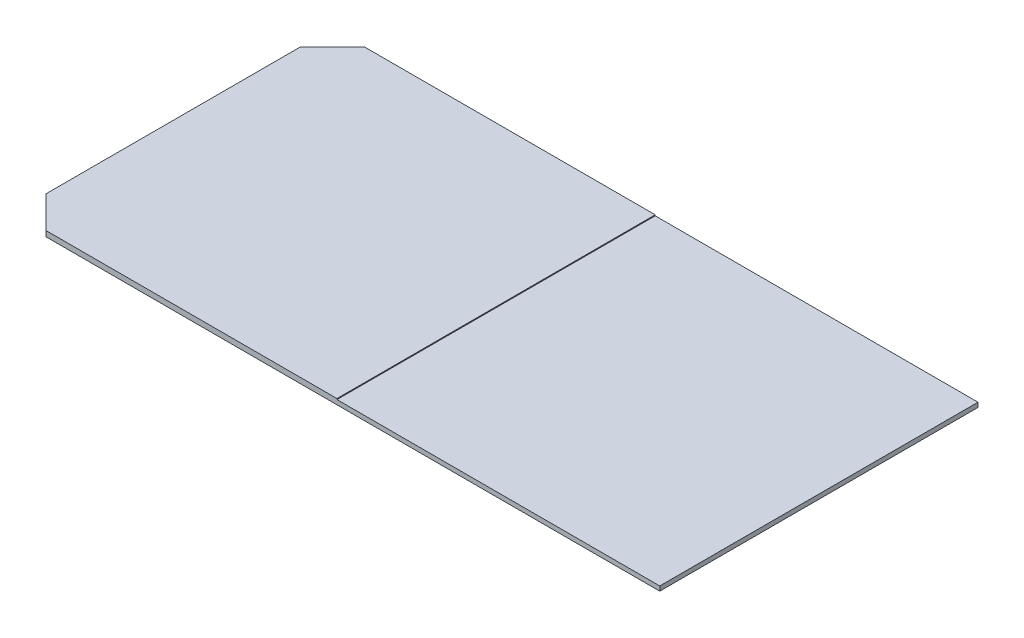
from build123d import *

# Parameters (mm, degrees)
SKETCH1_W           = 710
SKETCH1_H           = 350
BOSS_EXTRUDE1_DEPTH = 5
SKETCH2_W           = 355
SKETCH2_H           = 350
BOSS_EXTRUDE2_DEPTH = 1
CUT_EXTRUDE1_DEPTH  = 792.603436071


with BuildPart() as part:
    # Sketch1 → Boss-Extrude1 (new body)
    with BuildSketch(Plane(origin=(0, 0, 0), x_dir=(1, 0, 0), z_dir=(0, 1, 0))):
        with Locations((355, 175)):
            Rectangle(SKETCH1_W, SKETCH1_H)
    extrude(amount=BOSS_EXTRUDE1_DEPTH)

    # Sketch2 → Boss-Extrude2 (add)
    with BuildSketch(Plane(origin=(0, 5, 0), x_dir=(1, 0, 0), z_dir=(0, 1, 0))):
        with Locations((177.5, 175)):
            Rectangle(SKETCH2_W, SKETCH2_H)
    extrude(amount=BOSS_EXTRUDE2_DEPTH)

    # Sketch3 → Cut-Extrude1 (cut, through all)
    with BuildSketch(Plane(origin=(0, 6, 0), x_dir=(1, 0, 0), z_dir=(0, 1, 0))):
        Polygon((0, 350), (0, 315), (35, 350), align=None)
        Polygon((35, 0), (0, 35), (0, 0), align=None)
    extrude(amount=-CUT_EXTRUDE1_DEPTH, mode=Mode.SUBTRACT)


solid = part.part
